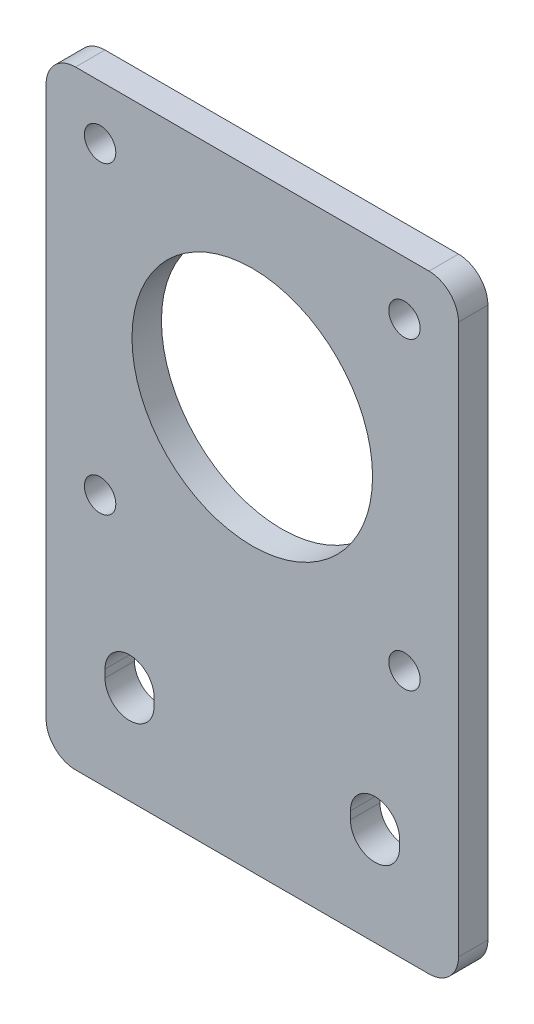
from build123d import *

# Parameters (mm, degrees)
SKETCH_1_R      = 1.6
EXTRUDE_1_DEPTH = 3


with BuildPart() as part:
    # 草图1 → 凸台-拉伸1 (new body)
    # profile 1 of 2: a face of its own
    with BuildSketch(Plane.XY):
        with BuildLine():
            Line((0, 27.154799922), (0, 35.904799922))
            Line((0, 35.904799922), (-18, 35.904799922))
            ThreePointArc((-18, 35.904799922), (-20.121320344, 35.026120265), (-21, 32.904799922))
            Line((-21, 32.904799922), (-21, -23.095200078))
            ThreePointArc((-21, -23.095200078), (-20.121320344, -25.216520422), (-18, -26.095200078))
            Line((-18, -26.095200078), (0, -26.095200078))
            Line((0, -26.095200078), (0, 2.654799922))
            ThreePointArc((0, 2.654799922), (-12.25, 14.904799922), (0, 27.154799922))
        make_face()
        with BuildLine():
            ThreePointArc((-10, -16.495200078), (-12.5, -18.995200078), (-15, -16.495200078))
            Line((-15, -16.495200078), (-15, -15.695200078))
            ThreePointArc((-15, -15.695200078), (-12.5, -13.195200078), (-10, -15.695200078))
            Line((-10, -15.695200078), (-10, -16.495200078))
        make_face(mode=Mode.SUBTRACT)
        with Locations((-15.5, -0.595200078)):
            Circle(SKETCH_1_R, mode=Mode.SUBTRACT)
        with Locations((-15.5, 30.404799922)):
            Circle(SKETCH_1_R, mode=Mode.SUBTRACT)
    # profile 2 of 2: a face of its own
    with BuildSketch(Plane.XY):
        with BuildLine():
            Line((18, 35.904799922), (0, 35.904799922))
            Line((0, 35.904799922), (0, 27.154799922))
            ThreePointArc((0, 27.154799922), (8.66205807, 23.566857991), (12.25, 14.904799922))
            ThreePointArc((12.25, 14.904799922), (8.66205807, 6.242741852), (0, 2.654799922))
            Line((0, 2.654799922), (0, -26.095200078))
            Line((0, -26.095200078), (18, -26.095200078))
            ThreePointArc((18, -26.095200078), (20.121320344, -25.216520422), (21, -23.095200078))
            Line((21, -23.095200078), (21, 32.904799922))
            ThreePointArc((21, 32.904799922), (20.121320344, 35.026120265), (18, 35.904799922))
        make_face()
        with BuildLine():
            Line((15, -15.695200078), (15, -16.495200078))
            ThreePointArc((15, -16.495200078), (12.5, -18.995200078), (10, -16.495200078))
            Line((10, -16.495200078), (10, -15.695200078))
            ThreePointArc((10, -15.695200078), (12.5, -13.195200078), (15, -15.695200078))
        make_face(mode=Mode.SUBTRACT)
        with Locations((15.5, -0.595200078)):
            Circle(SKETCH_1_R, mode=Mode.SUBTRACT)
        with Locations((15.5, 30.404799922)):
            Circle(SKETCH_1_R, mode=Mode.SUBTRACT)
    extrude(amount=EXTRUDE_1_DEPTH)


solid = part.part
